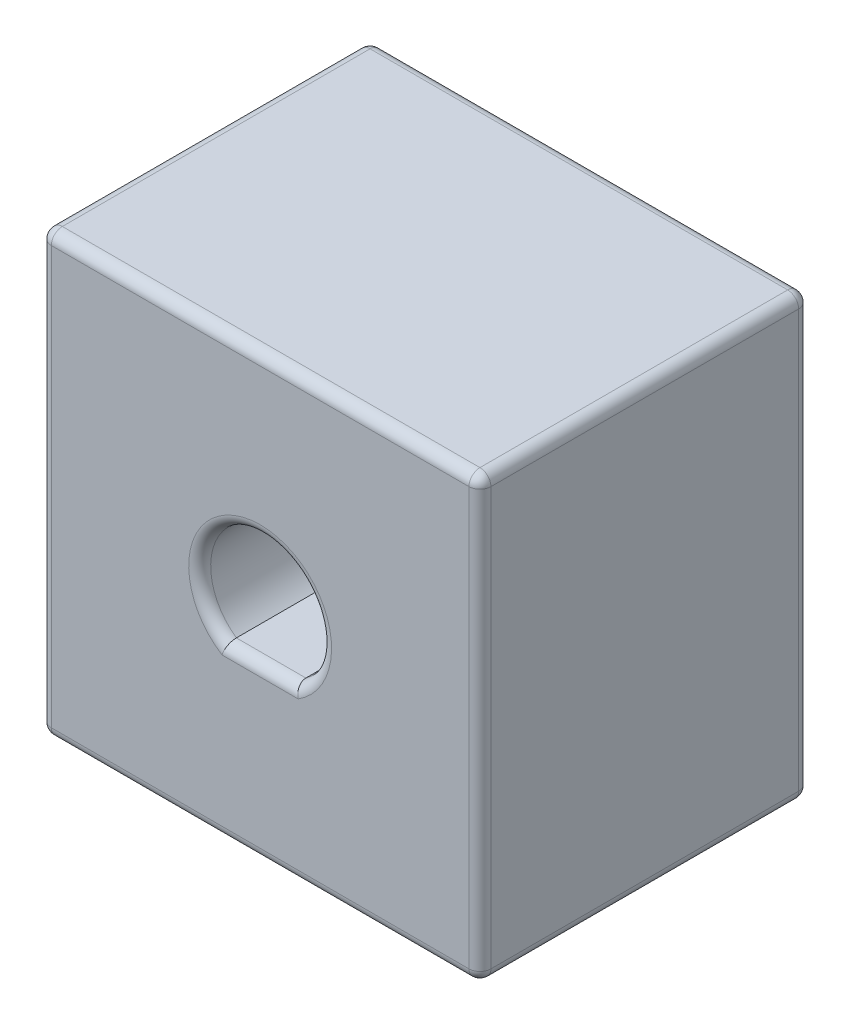
from build123d import *

# Parameters (mm, degrees)
ESQUISSE1_W        = 20
ESQUISSE1_H        = 20
BOSS_EXTRU_1_DEPTH = 15
CONG_1_R           = 0.5


with BuildPart() as part:
    # Esquisse1 → Boss.-Extru.1 (new body)
    with BuildSketch(Plane.XY):
        Rectangle(ESQUISSE1_W, ESQUISSE1_H)
        with BuildLine():
            Line((1.58113883, -2.25), (-1.58113883, -2.25))
            ThreePointArc((-1.58113883, -2.25), (0, 2.75), (1.58113883, -2.25))
        make_face(mode=Mode.SUBTRACT)
    extrude(amount=BOSS_EXTRU_1_DEPTH)

    # Congé1
    cong_1_edges = [part.edges().sort_by_distance(p)[0] for p in [
        (0, -2.25, 0),
        (0, 2.75, 0),
        (0, -2.25, 15),
        (-10, -10, 7.5),
        (-10, 10, 7.5),
        (10, 10, 7.5),
        (10, -10, 7.5),
        (0, -10, 15),
        (10, 0, 15),
        (0, 10, 15),
        (-10, 0, 15),
        (0, 2.75, 15),
        (-10, 0, 0),
        (0, 10, 0),
        (10, 0, 0),
        (0, -10, 0),
    ]]
    fillet(cong_1_edges, radius=CONG_1_R)


solid = part.part
